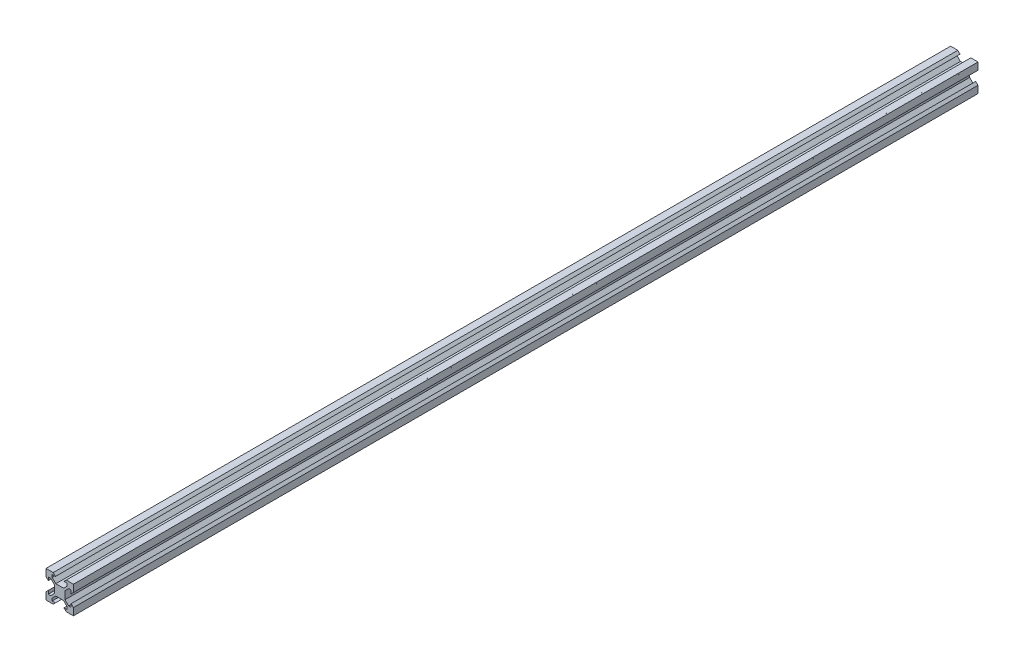
from build123d import *

# Parameters (mm, degrees)
BOSS_EXTRUDE1_DEPTH = 660


with BuildPart() as part:
    # Sketch1 → Boss-Extrude1 (new body)
    with BuildSketch(Plane.XY):
        Polygon((2.834320347, 3.893970342), (-2.834320347, 3.893970342), (-5.5, 6.558849663), (-5.5, 8.349069506), (-3.1, 8.349069506), (-4.75, 9.998574117), (-10, 9.998574117), (-10, 4.746997406), (-8.35, 3.097492795), (-8.350720674, 5.497492687), (-6.560500912, 5.498030255), (-3.894821259, 2.833150935), (-3.894821259, -2.833150935), (-6.560500912, -5.498030255), (-8.350720674, -5.497492687), (-8.35, -3.097492795), (-10, -4.746997406), (-10, -9.998574117), (-4.75, -9.998574117), (-3.1, -8.349069506), (-5.5, -8.349069506), (-5.5, -6.558849663), (-2.834320347, -3.893970342), (2.834320347, -3.893970342), (5.5, -6.558849663), (5.5, -8.349069506), (3.1, -8.349069506), (4.75, -9.998574117), (10, -9.998574117), (10, -4.746997406), (8.35, -3.097492795), (8.350720674, -5.497492687), (6.560500912, -5.498030255), (3.894821259, -2.833150935), (3.894821259, 2.833150935), (6.560500912, 5.498030255), (8.350720674, 5.497492687), (8.35, 3.097492795), (10, 4.746997406), (10, 9.998574117), (4.75, 9.998574117), (3.1, 8.349069506), (5.5, 8.349069506), (5.5, 6.558849663), align=None)
    extrude(amount=BOSS_EXTRUDE1_DEPTH)


solid = part.part
